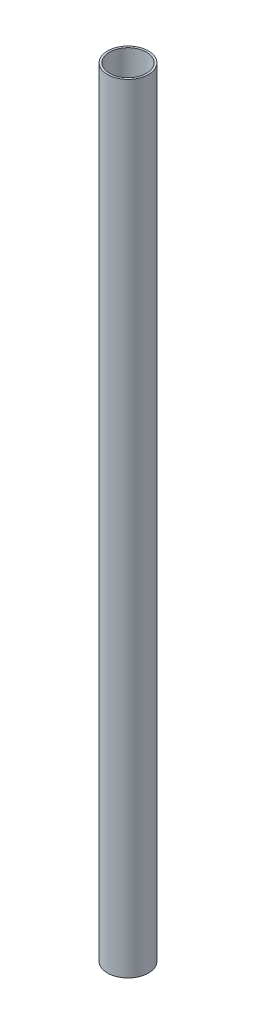
from build123d import *

# Parameters (mm, degrees)
SKETCH1_R           = 10
SKETCH1_R_2         = 9
BOSS_EXTRUDE1_DEPTH = 380


with BuildPart() as part:
    # Sketch1 → Boss-Extrude1 (new body)
    with BuildSketch(Plane(origin=(0, 0, 0), x_dir=(1, 0, 0), z_dir=(0, 1, 0))):
        with Locations(Location((0, 0, 0), (0, 0, 270))):
            Circle(SKETCH1_R)
        with Locations(Location((0, 0, 0), (0, 0, 270))):
            Circle(SKETCH1_R_2, mode=Mode.SUBTRACT)
    extrude(amount=BOSS_EXTRUDE1_DEPTH)


solid = part.part
